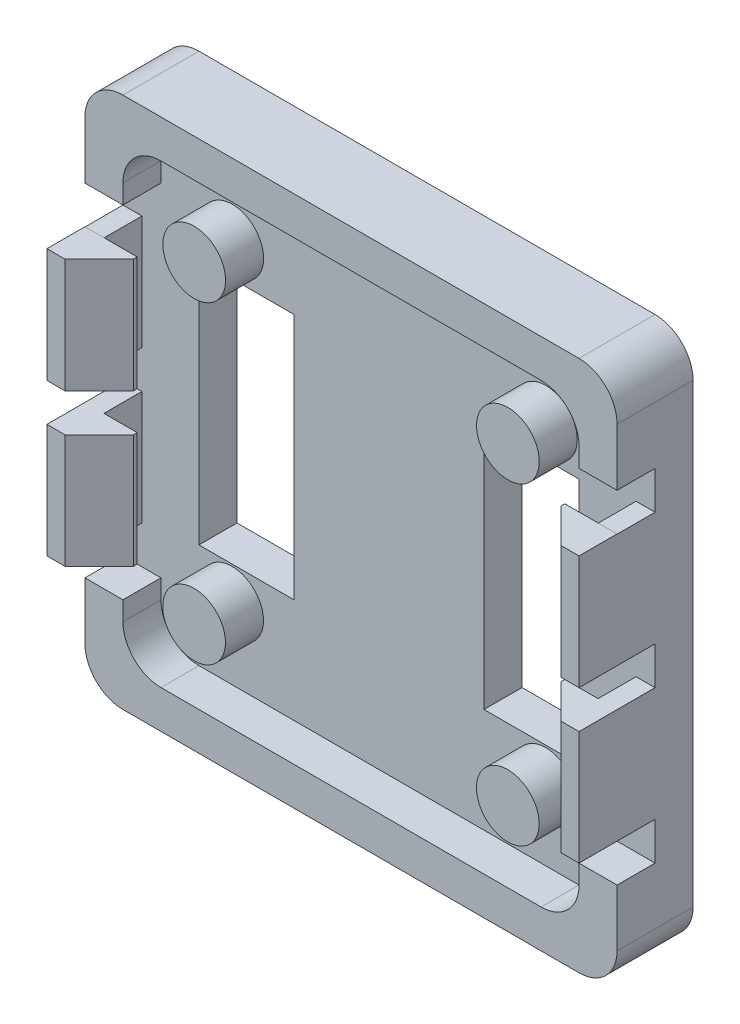
from build123d import *

# Parameters (mm, degrees)
BOSS_EXTRU_1_DEPTH           = 4
ESQUISSE2_R                  = 1.65
ENL_V_MAT_EXTRU_1_DEPTH      = 2
ESQUISSE3_W                  = 5
ESQUISSE3_H                  = 13
ENL_V_MAT_EXTRU_2_DEPTH      = 20.899748742
ESQUISSE4_W                  = 2.75
ESQUISSE4_H                  = 5.994249795
ESQUISSE4_H_2                = 6.005750205
BOSS_EXTRU_2_DEPTH           = 2
CHANFREIN3_SIZE              = 1.8
CHANFREIN3_OF_SYM_TRIE1_SIZE = 1.8


with BuildPart() as part:
    # Esquisse1 → Boss.-Extru.1 (new body)
    with BuildSketch(Plane.XY):
        with BuildLine():
            Line((12, -14), (-12, -14))
            ThreePointArc((-12, -14), (-13.414213562, -13.414213562), (-14, -12))
            Line((-14, -12), (-14, 12))
            ThreePointArc((-14, 12), (-13.414213562, 13.414213562), (-12, 14))
            Line((-12, 14), (12, 14))
            ThreePointArc((12, 14), (13.414213562, 13.414213562), (14, 12))
            Line((14, 12), (14, -12))
            ThreePointArc((14, -12), (13.414213562, -13.414213562), (12, -14))
        make_face()
    extrude(amount=BOSS_EXTRU_1_DEPTH)

    # Esquisse2 → Enlèv. mat.-Extru.1 (cut)
    with BuildSketch(Plane.XY.offset(4)):
        with BuildLine():
            Line((-10, -12), (10, -12))
            ThreePointArc((10, -12), (11.414213562, -11.414213562), (12, -10))
            Line((12, -10), (12, -9))
            Line((12, -9), (14, -9))
            Line((14, -9), (14, -7))
            Line((14, -7), (13, -7))
            Line((13, -7), (13, -1.005750205))
            Line((13, -1.005750205), (14, -1.005750205))
            Line((14, -1.005750205), (14, 0.994249795))
            Line((14, 0.994249795), (13, 0.994249795))
            Line((13, 0.994249795), (13, 6.988499589))
            Line((13, 6.988499589), (14, 6.988499589))
            Line((14, 6.988499589), (14, 8.988499589))
            Line((14, 8.988499589), (12, 8.988499589))
            Line((12, 8.988499589), (12, 10))
            ThreePointArc((12, 10), (11.414213562, 11.414213562), (10, 12))
            Line((10, 12), (-10, 12))
            ThreePointArc((-10, 12), (-11.414213562, 11.414213562), (-12, 10))
            Line((-12, 10), (-12, 8.988499589))
            Line((-12, 8.988499589), (-14, 8.988499589))
            Line((-14, 8.988499589), (-14, 6.988499589))
            Line((-14, 6.988499589), (-13, 6.988499589))
            Line((-13, 6.988499589), (-13, 0.994249795))
            Line((-13, 0.994249795), (-14, 0.994249795))
            Line((-14, 0.994249795), (-14, -1.005750205))
            Line((-14, -1.005750205), (-13, -1.005750205))
            Line((-13, -1.005750205), (-13, -7))
            Line((-13, -7), (-14, -7))
            Line((-14, -7), (-14, -9))
            Line((-14, -9), (-12, -9))
            Line((-12, -9), (-12, -10))
            ThreePointArc((-12, -10), (-11.414213562, -11.414213562), (-10, -12))
        make_face()
        with Locations((-8.25, 8.25)):
            Circle(ESQUISSE2_R, mode=Mode.SUBTRACT)
        with Locations((8.255750205, 8.244249795)):
            Circle(ESQUISSE2_R, mode=Mode.SUBTRACT)
        with Locations((8.25, -8.261500411)):
            Circle(ESQUISSE2_R, mode=Mode.SUBTRACT)
        with Locations((-8.255750205, -8.255750205)):
            Circle(ESQUISSE2_R, mode=Mode.SUBTRACT)
    extrude(amount=-ENL_V_MAT_EXTRU_1_DEPTH, mode=Mode.SUBTRACT)

    # Esquisse3 → Enlèv. mat.-Extru.2 (cut, through all)
    with BuildSketch(Plane.XY.offset(2)):
        with Locations((-7.5, 0)):
            Rectangle(ESQUISSE3_W, ESQUISSE3_H)
        with Locations((7.5, 0)):
            Rectangle(ESQUISSE3_W, ESQUISSE3_H)
    extrude(amount=-ENL_V_MAT_EXTRU_2_DEPTH, mode=Mode.SUBTRACT)

    # Esquisse4 → Boss.-Extru.2 (add)
    with BuildSketch(Plane.XY.offset(4)):
        with Locations((-12.625, -4.002875103)):
            Rectangle(ESQUISSE4_W, ESQUISSE4_H)
        with Locations((-12.625, 3.997124897)):
            Rectangle(ESQUISSE4_W, ESQUISSE4_H_2)
    boss_extru_2 = extrude(amount=BOSS_EXTRU_2_DEPTH)

    # Chanfrein3
    chanfrein3_edges = [part.edges().sort_by_distance(p)[0] for p in [
        (-11.25, 3.997124897, 6),
        (-11.25, -4.002875103, 6),
    ]]
    chamfer(chanfrein3_edges, length=CHANFREIN3_SIZE)

    # Symétrie1: Boss.-Extru.2 across plane
    add(boss_extru_2.mirror(Plane(origin=(0, 0, 0), x_dir=(0, 0, 1), z_dir=(1, 0, 0))))

    # Chanfrein3 of Symétrie1
    chanfrein3_of_sym_trie1_edges = [part.edges().sort_by_distance(p)[0] for p in [
        (11.25, 3.997124897, 6),
        (11.25, -4.002875103, 6),
    ]]
    chamfer(chanfrein3_of_sym_trie1_edges, length=CHANFREIN3_OF_SYM_TRIE1_SIZE)


solid = part.part
